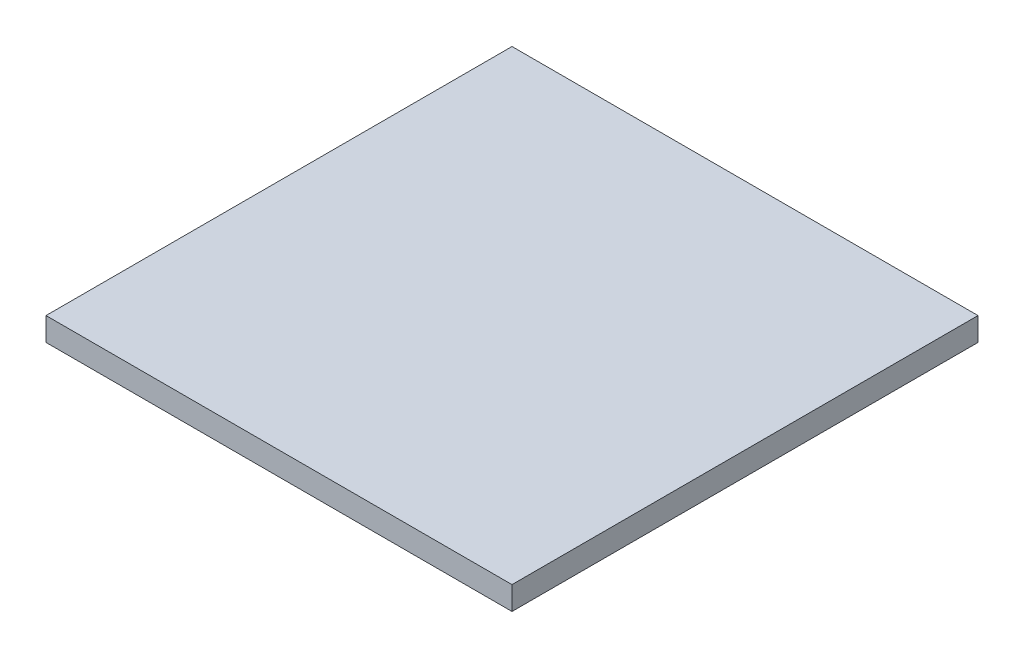
from build123d import *

# Parameters (mm, degrees)
SKETCH1_W           = 127
SKETCH1_H           = 127
BOSS_EXTRUDE1_DEPTH = 6.35


with BuildPart() as part:
    # Sketch1 → Boss-Extrude1 (new body)
    with BuildSketch(Plane(origin=(0, 0, 0), x_dir=(1, 0, 0), z_dir=(0, 1, 0))):
        Rectangle(SKETCH1_W, SKETCH1_H)
    extrude(amount=BOSS_EXTRUDE1_DEPTH)


solid = part.part
